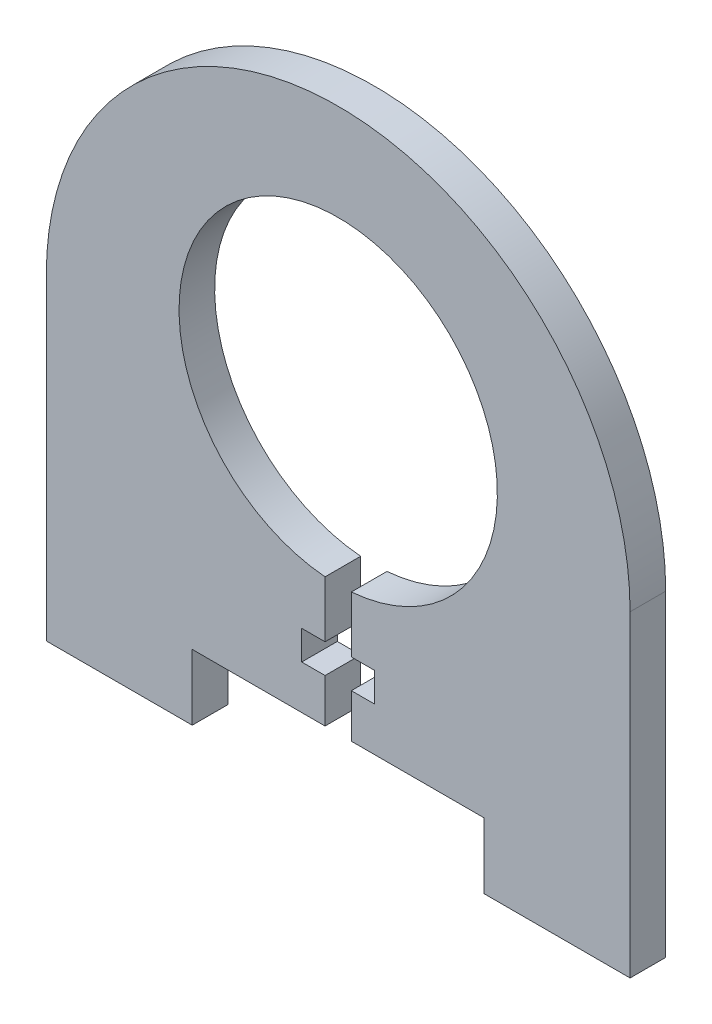
from build123d import *

# Parameters (mm, degrees)
BOSS_EXTRUDE1_DEPTH = 3.0988
CUT_EXTRUDE1_REACH  = 48.812
SKETCH2_R           = 13.85
CUT_EXTRUDE2_REACH  = 48.812
SKETCH3_W           = 25.4
SKETCH3_H           = 5.715
CUT_EXTRUDE4_REACH  = 48.812


with BuildPart() as part:
    # Sketch1 → Boss-Extrude1 (new body)
    with BuildSketch(Plane.XY):
        with BuildLine():
            Line((25.4, -13.800079969), (-25.4, -13.800079969))
            Line((-25.4, -13.800079969), (-25.4, 13.800079969))
            ThreePointArc((-25.4, 13.800079969), (0, 39.200079969), (25.4, 13.800079969))
            Line((25.4, 13.800079969), (25.4, -13.800079969))
        make_face()
    extrude(amount=BOSS_EXTRUDE1_DEPTH)

    # Sketch2 → Cut-Extrude1 (cut, up to next)
    with BuildSketch(Plane.XY.offset(3.0988), mode=Mode.PRIVATE) as cut_extrude1_sk1:
        with Locations((0, 16.964919969)):
            Circle(SKETCH2_R)
    cut_extrude1_tool1 = extrude(cut_extrude1_sk1.sketch, amount=-CUT_EXTRUDE1_REACH, mode=Mode.PRIVATE) & part.part
    add(cut_extrude1_tool1.solids().sort_by_distance((0, 16.96492, 3.0988))[0], mode=Mode.SUBTRACT)

    # Sketch3 → Cut-Extrude2 (cut, up to next)
    with BuildSketch(Plane.XY.offset(3.0988), mode=Mode.PRIVATE) as cut_extrude2_sk1:
        with Locations((0, -10.942579969)):
            Rectangle(SKETCH3_W, SKETCH3_H)
    cut_extrude2_tool1 = extrude(cut_extrude2_sk1.sketch, amount=-CUT_EXTRUDE2_REACH, mode=Mode.PRIVATE) & part.part
    add(cut_extrude2_tool1.solids().sort_by_distance((0, -10.94258, 3.0988))[0], mode=Mode.SUBTRACT)

    # Sketch5 → Cut-Extrude4 (cut, up to next)
    with BuildSketch(Plane.XY.offset(3.0988), mode=Mode.PRIVATE) as cut_extrude4_sk1:
        Polygon((3.175, -4.275079969), (1.143, -4.275079969), (1.143, -8.085079969), (-1.143, -8.085079969), (-1.143, -4.275079969), (-3.175, -4.275079969), (-3.175, -1.735079969), (-1.143, -1.735079969), (-1.143, 5.884920031), (1.143, 5.884920031), (1.143, -1.735079969), (3.175, -1.735079969), align=None)
    cut_extrude4_tool1 = extrude(cut_extrude4_sk1.sketch, amount=-CUT_EXTRUDE4_REACH, mode=Mode.PRIVATE) & part.part
    add(cut_extrude4_tool1.solids().sort_by_distance((0, -1.565423, 3.0988))[0], mode=Mode.SUBTRACT)


solid = part.part
